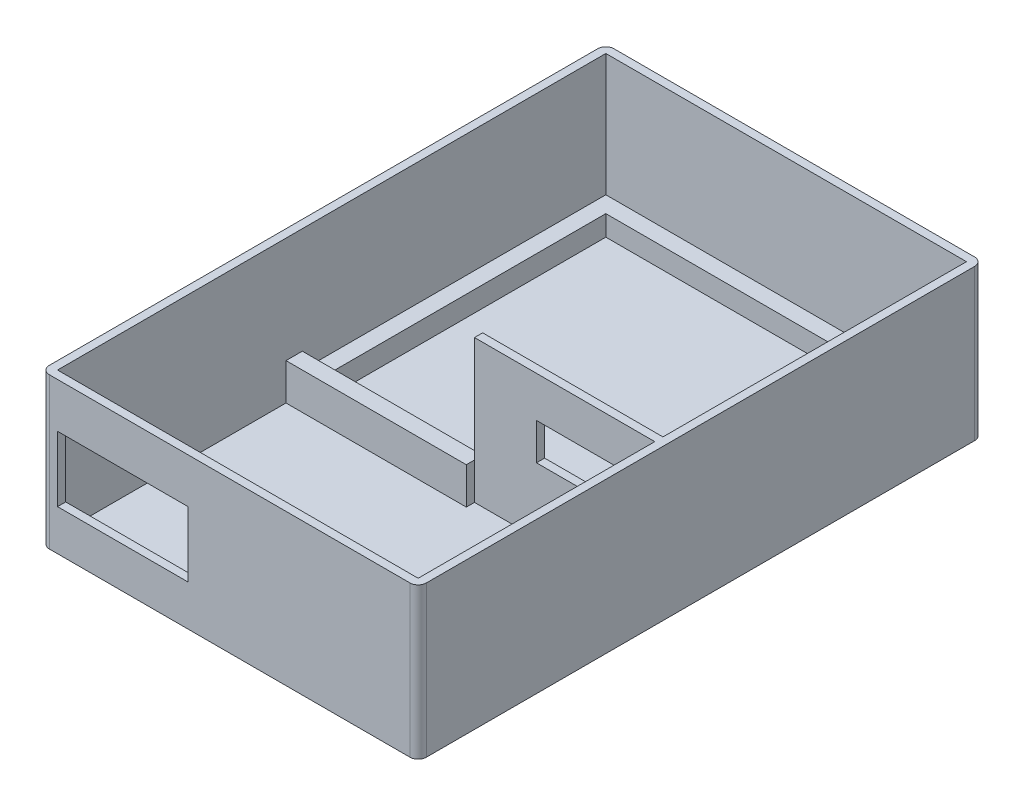
from build123d import *

# Parameters (mm, degrees)
SKETCH1_W           = 46.2
SKETCH1_H           = 39.2
SKETCH1_W_2         = 40.2
SKETCH1_H_2         = 33.2
BOSS_EXTRUDE1_DEPTH = 2.5
SKETCH3_W           = 46.2
SKETCH3_H           = 39.2
BOSS_EXTRUDE2_DEPTH = 1
SKETCH4_W           = 46.2
SKETCH4_H           = 39.2
SKETCH4_W_2         = 44.2
SKETCH4_H_2         = 37.2
BOSS_EXTRUDE3_DEPTH = 15
SKETCH5_W           = 9.5
SKETCH5_H           = 4.5
CUT_EXTRUDE1_DEPTH  = 15
SKETCH6_W           = 46.2
SKETCH6_H           = 30
BOSS_EXTRUDE4_DEPTH = 1
SKETCH7_W           = 46.2
SKETCH7_H           = 30
SKETCH7_W_2         = 44.2
SKETCH7_H_2         = 28
BOSS_EXTRUDE5_DEPTH = 17.5
SKETCH8_W           = 22.1
SKETCH8_H           = 2
CUT_EXTRUDE2_DEPTH  = 13
SKETCH9_W           = 22.1
SKETCH9_H           = 1
CUT_EXTRUDE3_DEPTH  = 17.5
SKETCH10_W          = 16
SKETCH10_H          = 8
CUT_EXTRUDE4_DEPTH  = 10
FILLET1_R           = 1


with BuildPart() as part:
    # Sketch1 → Boss-Extrude1 (new body)
    with BuildSketch(Plane(origin=(0, 0, 0), x_dir=(1, 0, 0), z_dir=(0, 1, 0))):
        Rectangle(SKETCH1_W, SKETCH1_H)
        Rectangle(SKETCH1_W_2, SKETCH1_H_2, mode=Mode.SUBTRACT)
    extrude(amount=BOSS_EXTRUDE1_DEPTH)

    # Sketch3 → Boss-Extrude2 (add)
    with BuildSketch(Plane.XZ):
        Rectangle(SKETCH3_W, SKETCH3_H)
    extrude(amount=BOSS_EXTRUDE2_DEPTH)

    # Sketch4 → Boss-Extrude3 (add)
    with BuildSketch(Plane(origin=(0, 2.5, 0), x_dir=(1, 0, 0), z_dir=(0, 1, 0))):
        Rectangle(SKETCH4_W, SKETCH4_H)
        Rectangle(SKETCH4_W_2, SKETCH4_H_2, mode=Mode.SUBTRACT)
    extrude(amount=BOSS_EXTRUDE3_DEPTH)

    # Sketch5 → Cut-Extrude1 (cut)
    with BuildSketch(Plane(origin=(0, 0, 18.6), x_dir=(-1, 0, 0), z_dir=(0, 0, -1))):
        with Locations((-12.35, 10.25)):
            Rectangle(SKETCH5_W, SKETCH5_H)
    extrude(amount=-CUT_EXTRUDE1_DEPTH, mode=Mode.SUBTRACT)

    # Sketch6 → Boss-Extrude4 (add)
    with BuildSketch(Plane.XZ.offset(1)):
        with Locations((0, 34.6)):
            Rectangle(SKETCH6_W, SKETCH6_H)
    extrude(amount=-BOSS_EXTRUDE4_DEPTH)

    # Sketch7 → Boss-Extrude5 (add)
    with BuildSketch(Plane(origin=(0, 0, 0), x_dir=(1, 0, 0), z_dir=(0, 1, 0))):
        with Locations((0, -34.6)):
            Rectangle(SKETCH7_W, SKETCH7_H)
        with Locations((0, -34.6)):
            Rectangle(SKETCH7_W_2, SKETCH7_H_2, mode=Mode.SUBTRACT)
    extrude(amount=BOSS_EXTRUDE5_DEPTH)

    # Sketch8 → Cut-Extrude2 (cut)
    with BuildSketch(Plane(origin=(0, 17.5, 0), x_dir=(1, 0, 0), z_dir=(0, 1, 0))):
        with Locations((-11.05, -19.6)):
            Rectangle(SKETCH8_W, SKETCH8_H)
    extrude(amount=-CUT_EXTRUDE2_DEPTH, mode=Mode.SUBTRACT)

    # Sketch9 → Cut-Extrude3 (cut)
    with BuildSketch(Plane(origin=(0, 17.5, 0), x_dir=(1, 0, 0), z_dir=(0, 1, 0))):
        with Locations((11.05, -20.1)):
            Rectangle(SKETCH9_W, SKETCH9_H)
    extrude(amount=-CUT_EXTRUDE3_DEPTH, mode=Mode.SUBTRACT)

    # Sketch10 → Cut-Extrude4 (cut)
    with BuildSketch(Plane.XY.offset(49.6)):
        with Locations((-13.1, 8)):
            Rectangle(SKETCH10_W, SKETCH10_H)
    extrude(amount=-CUT_EXTRUDE4_DEPTH, mode=Mode.SUBTRACT)

    # Fillet1
    fillet1_edges = [part.edges().sort_by_distance(p)[0] for p in [
        (-23.1, 8.25, -19.6),
        (23.1, 8.25, -19.6),
        (-23.1, 8.25, 49.6),
        (23.1, 8.25, 49.6),
    ]]
    fillet(fillet1_edges, radius=FILLET1_R)


solid = part.part
